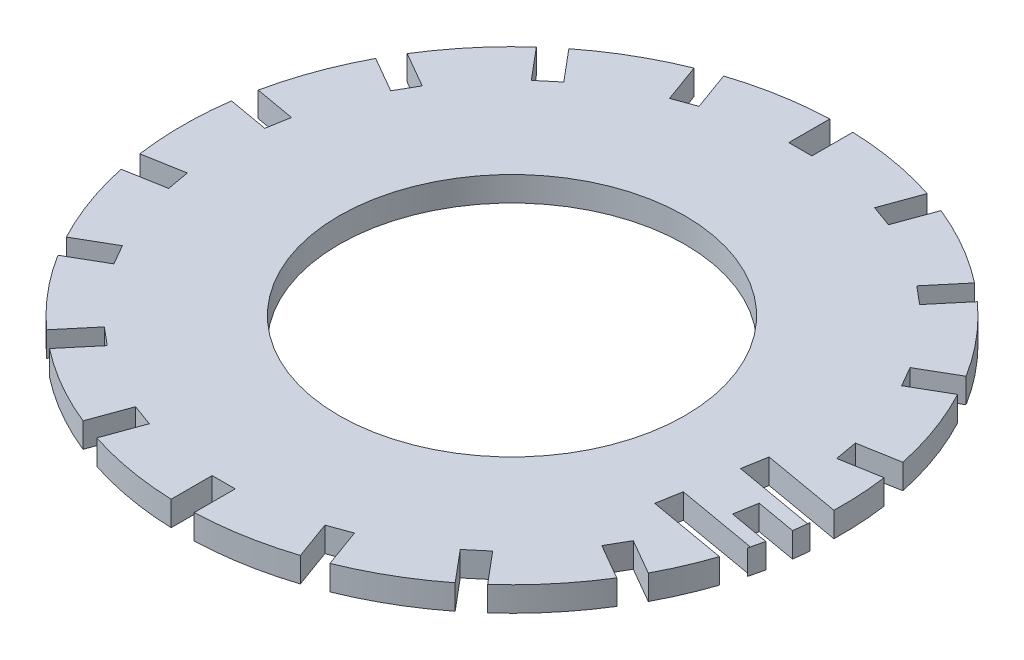
from build123d import *

# Parameters (mm, degrees)
ESQUISSE1_R             = 40
ESQUISSE1_R_2           = 21
BOSS_EXTRU_1_DEPTH      = 3
ENL_V_MAT_EXTRU_1_REACH = 58.648
ESQUISSE2_W             = 2.8
ESQUISSE2_H             = 5
ENL_V_MAT_EXTRU_2_DEPTH = 10


with BuildPart() as part:
    # Esquisse1 → Boss.-Extru.1 (new body)
    with BuildSketch(Plane(origin=(0, 0, 0), x_dir=(1, 0, 0), z_dir=(0, 1, 0))):
        with Locations(Location((0, 0, 0), (0, 0, 270))):
            Circle(ESQUISSE1_R)
        with Locations(Location((0, 0, 0), (0, 0, 270))):
            Circle(ESQUISSE1_R_2, mode=Mode.SUBTRACT)
    extrude(amount=BOSS_EXTRU_1_DEPTH)

    # Esquisse2 → Enlèv. mat.-Extru.1 (cut, up to next)
    with BuildSketch(Plane(origin=(0, 3, 0), x_dir=(1, 0, 0), z_dir=(0, 1, 0)), mode=Mode.PRIVATE) as enl_v_mat_extru_1_sk1:
        Polygon((14.996375402, 37.108876631), (13.286274685, 32.410413527), (10.655135347, 33.368069928), (12.365236064, 38.066533032), align=None)
    enl_v_mat_extru_1_tool1 = extrude(enl_v_mat_extru_1_sk1.sketch, amount=-ENL_V_MAT_EXTRU_1_REACH, mode=Mode.PRIVATE) & part.part
    # Esquisse2 → Enlèv. mat.-Extru.1 (cut, up to next)
    with BuildSketch(Plane(origin=(0, 3, 0), x_dir=(1, 0, 0), z_dir=(0, 1, 0)), mode=Mode.PRIVATE) as enl_v_mat_extru_1_sk2:
        with Locations((0, 37.5)):
            Rectangle(ESQUISSE2_W, ESQUISSE2_H)
    enl_v_mat_extru_1_tool2 = extrude(enl_v_mat_extru_1_sk2.sketch, amount=-ENL_V_MAT_EXTRU_1_REACH, mode=Mode.PRIVATE) & part.part
    # Esquisse2 → Enlèv. mat.-Extru.1 (cut, up to next)
    with BuildSketch(Plane(origin=(0, 3, 0), x_dir=(1, 0, 0), z_dir=(0, 1, 0)), mode=Mode.PRIVATE) as enl_v_mat_extru_1_sk3:
        Polygon((26.783966608, 29.741875071), (23.570028559, 25.911652856), (21.425104119, 27.711458163), (24.639042167, 31.541680378), align=None)
    enl_v_mat_extru_1_tool3 = extrude(enl_v_mat_extru_1_sk3.sketch, amount=-ENL_V_MAT_EXTRU_1_REACH, mode=Mode.PRIVATE) & part.part
    # Esquisse2 → Enlèv. mat.-Extru.1 (cut, up to next)
    with BuildSketch(Plane(origin=(0, 3, 0), x_dir=(1, 0, 0), z_dir=(0, 1, 0)), mode=Mode.PRIVATE) as enl_v_mat_extru_1_sk4:
        Polygon((35.341016151, 18.787564435), (31.010889132, 16.287564435), (29.610889132, 18.712435565), (33.941016151, 21.212435565), align=None)
    enl_v_mat_extru_1_tool4 = extrude(enl_v_mat_extru_1_sk4.sketch, amount=-ENL_V_MAT_EXTRU_1_REACH, mode=Mode.PRIVATE) & part.part
    # Esquisse2 → Enlèv. mat.-Extru.1 (cut, up to next)
    with BuildSketch(Plane(origin=(0, 3, 0), x_dir=(1, 0, 0), z_dir=(0, 1, 0)), mode=Mode.PRIVATE) as enl_v_mat_extru_1_sk5:
        Polygon((39.635417569, 5.567196252), (34.711378804, 4.698955364), (34.225163907, 7.456417073), (39.149202672, 8.324657961), align=None)
    enl_v_mat_extru_1_tool5 = extrude(enl_v_mat_extru_1_sk5.sketch, amount=-ENL_V_MAT_EXTRU_1_REACH, mode=Mode.PRIVATE) & part.part
    # Esquisse2 → Enlèv. mat.-Extru.1 (cut, up to next)
    with BuildSketch(Plane(origin=(0, 3, 0), x_dir=(1, 0, 0), z_dir=(0, 1, 0)), mode=Mode.PRIVATE) as enl_v_mat_extru_1_sk6:
        Polygon((39.149202672, -8.324657961), (34.225163907, -7.456417073), (34.711378804, -4.698955364), (39.635417569, -5.567196252), align=None)
    enl_v_mat_extru_1_tool6 = extrude(enl_v_mat_extru_1_sk6.sketch, amount=-ENL_V_MAT_EXTRU_1_REACH, mode=Mode.PRIVATE) & part.part
    # Esquisse2 → Enlèv. mat.-Extru.1 (cut, up to next)
    with BuildSketch(Plane(origin=(0, 3, 0), x_dir=(1, 0, 0), z_dir=(0, 1, 0)), mode=Mode.PRIVATE) as enl_v_mat_extru_1_sk7:
        Polygon((33.941016151, -21.212435565), (29.610889132, -18.712435565), (31.010889132, -16.287564435), (35.341016151, -18.787564435), align=None)
    enl_v_mat_extru_1_tool7 = extrude(enl_v_mat_extru_1_sk7.sketch, amount=-ENL_V_MAT_EXTRU_1_REACH, mode=Mode.PRIVATE) & part.part
    # Esquisse2 → Enlèv. mat.-Extru.1 (cut, up to next)
    with BuildSketch(Plane(origin=(0, 3, 0), x_dir=(1, 0, 0), z_dir=(0, 1, 0)), mode=Mode.PRIVATE) as enl_v_mat_extru_1_sk8:
        Polygon((24.639042167, -31.541680378), (21.425104119, -27.711458163), (23.570028559, -25.911652856), (26.783966608, -29.741875071), align=None)
    enl_v_mat_extru_1_tool8 = extrude(enl_v_mat_extru_1_sk8.sketch, amount=-ENL_V_MAT_EXTRU_1_REACH, mode=Mode.PRIVATE) & part.part
    # Esquisse2 → Enlèv. mat.-Extru.1 (cut, up to next)
    with BuildSketch(Plane(origin=(0, 3, 0), x_dir=(1, 0, 0), z_dir=(0, 1, 0)), mode=Mode.PRIVATE) as enl_v_mat_extru_1_sk9:
        Polygon((12.365236064, -38.066533032), (10.655135347, -33.368069928), (13.286274686, -32.410413527), (14.996375402, -37.108876631), align=None)
    enl_v_mat_extru_1_tool9 = extrude(enl_v_mat_extru_1_sk9.sketch, amount=-ENL_V_MAT_EXTRU_1_REACH, mode=Mode.PRIVATE) & part.part
    # Esquisse2 → Enlèv. mat.-Extru.1 (cut, up to next)
    with BuildSketch(Plane(origin=(0, 3, 0), x_dir=(1, 0, 0), z_dir=(0, 1, 0)), mode=Mode.PRIVATE) as enl_v_mat_extru_1_sk10:
        with Locations((0, -37.5)):
            Rectangle(ESQUISSE2_W, ESQUISSE2_H)
    enl_v_mat_extru_1_tool10 = extrude(enl_v_mat_extru_1_sk10.sketch, amount=-ENL_V_MAT_EXTRU_1_REACH, mode=Mode.PRIVATE) & part.part
    # Esquisse2 → Enlèv. mat.-Extru.1 (cut, up to next)
    with BuildSketch(Plane(origin=(0, 3, 0), x_dir=(1, 0, 0), z_dir=(0, 1, 0)), mode=Mode.PRIVATE) as enl_v_mat_extru_1_sk11:
        Polygon((-14.996375402, -37.108876631), (-13.286274685, -32.410413527), (-10.655135347, -33.368069928), (-12.365236064, -38.066533032), align=None)
    enl_v_mat_extru_1_tool11 = extrude(enl_v_mat_extru_1_sk11.sketch, amount=-ENL_V_MAT_EXTRU_1_REACH, mode=Mode.PRIVATE) & part.part
    # Esquisse2 → Enlèv. mat.-Extru.1 (cut, up to next)
    with BuildSketch(Plane(origin=(0, 3, 0), x_dir=(1, 0, 0), z_dir=(0, 1, 0)), mode=Mode.PRIVATE) as enl_v_mat_extru_1_sk12:
        Polygon((-26.783966608, -29.741875071), (-23.570028559, -25.911652856), (-21.425104119, -27.711458163), (-24.639042167, -31.541680378), align=None)
    enl_v_mat_extru_1_tool12 = extrude(enl_v_mat_extru_1_sk12.sketch, amount=-ENL_V_MAT_EXTRU_1_REACH, mode=Mode.PRIVATE) & part.part
    # Esquisse2 → Enlèv. mat.-Extru.1 (cut, up to next)
    with BuildSketch(Plane(origin=(0, 3, 0), x_dir=(1, 0, 0), z_dir=(0, 1, 0)), mode=Mode.PRIVATE) as enl_v_mat_extru_1_sk13:
        Polygon((-35.341016151, -18.787564435), (-31.010889132, -16.287564435), (-29.610889132, -18.712435565), (-33.941016151, -21.212435565), align=None)
    enl_v_mat_extru_1_tool13 = extrude(enl_v_mat_extru_1_sk13.sketch, amount=-ENL_V_MAT_EXTRU_1_REACH, mode=Mode.PRIVATE) & part.part
    # Esquisse2 → Enlèv. mat.-Extru.1 (cut, up to next)
    with BuildSketch(Plane(origin=(0, 3, 0), x_dir=(1, 0, 0), z_dir=(0, 1, 0)), mode=Mode.PRIVATE) as enl_v_mat_extru_1_sk14:
        Polygon((-39.635417569, -5.567196252), (-34.711378804, -4.698955364), (-34.225163907, -7.456417073), (-39.149202672, -8.324657961), align=None)
    enl_v_mat_extru_1_tool14 = extrude(enl_v_mat_extru_1_sk14.sketch, amount=-ENL_V_MAT_EXTRU_1_REACH, mode=Mode.PRIVATE) & part.part
    # Esquisse2 → Enlèv. mat.-Extru.1 (cut, up to next)
    with BuildSketch(Plane(origin=(0, 3, 0), x_dir=(1, 0, 0), z_dir=(0, 1, 0)), mode=Mode.PRIVATE) as enl_v_mat_extru_1_sk15:
        Polygon((-39.149202672, 8.324657961), (-34.225163907, 7.456417073), (-34.711378804, 4.698955364), (-39.635417569, 5.567196252), align=None)
    enl_v_mat_extru_1_tool15 = extrude(enl_v_mat_extru_1_sk15.sketch, amount=-ENL_V_MAT_EXTRU_1_REACH, mode=Mode.PRIVATE) & part.part
    # Esquisse2 → Enlèv. mat.-Extru.1 (cut, up to next)
    with BuildSketch(Plane(origin=(0, 3, 0), x_dir=(1, 0, 0), z_dir=(0, 1, 0)), mode=Mode.PRIVATE) as enl_v_mat_extru_1_sk16:
        Polygon((-33.941016151, 21.212435565), (-29.610889132, 18.712435565), (-31.010889132, 16.287564435), (-35.341016151, 18.787564435), align=None)
    enl_v_mat_extru_1_tool16 = extrude(enl_v_mat_extru_1_sk16.sketch, amount=-ENL_V_MAT_EXTRU_1_REACH, mode=Mode.PRIVATE) & part.part
    # Esquisse2 → Enlèv. mat.-Extru.1 (cut, up to next)
    with BuildSketch(Plane(origin=(0, 3, 0), x_dir=(1, 0, 0), z_dir=(0, 1, 0)), mode=Mode.PRIVATE) as enl_v_mat_extru_1_sk17:
        Polygon((-24.639042167, 31.541680378), (-21.425104119, 27.711458163), (-23.570028559, 25.911652856), (-26.783966608, 29.741875071), align=None)
    enl_v_mat_extru_1_tool17 = extrude(enl_v_mat_extru_1_sk17.sketch, amount=-ENL_V_MAT_EXTRU_1_REACH, mode=Mode.PRIVATE) & part.part
    # Esquisse2 → Enlèv. mat.-Extru.1 (cut, up to next)
    with BuildSketch(Plane(origin=(0, 3, 0), x_dir=(1, 0, 0), z_dir=(0, 1, 0)), mode=Mode.PRIVATE) as enl_v_mat_extru_1_sk18:
        Polygon((-12.365236064, 38.066533032), (-10.655135347, 33.368069928), (-13.286274685, 32.410413527), (-14.996375402, 37.108876631), align=None)
    enl_v_mat_extru_1_tool18 = extrude(enl_v_mat_extru_1_sk18.sketch, amount=-ENL_V_MAT_EXTRU_1_REACH, mode=Mode.PRIVATE) & part.part
    add(enl_v_mat_extru_1_tool1.solids().sort_by_distance((12.825755, 3, -35.238473))[0], mode=Mode.SUBTRACT)
    add(enl_v_mat_extru_1_tool2.solids().sort_by_distance((0, 3, -37.5))[0], mode=Mode.SUBTRACT)
    add(enl_v_mat_extru_1_tool3.solids().sort_by_distance((24.104535, 3, -28.726667))[0], mode=Mode.SUBTRACT)
    add(enl_v_mat_extru_1_tool4.solids().sort_by_distance((32.475953, 3, -18.75))[0], mode=Mode.SUBTRACT)
    add(enl_v_mat_extru_1_tool5.solids().sort_by_distance((36.930291, 3, -6.511807))[0], mode=Mode.SUBTRACT)
    add(enl_v_mat_extru_1_tool6.solids().sort_by_distance((36.930291, 3, 6.511807))[0], mode=Mode.SUBTRACT)
    add(enl_v_mat_extru_1_tool7.solids().sort_by_distance((32.475953, 3, 18.75))[0], mode=Mode.SUBTRACT)
    add(enl_v_mat_extru_1_tool8.solids().sort_by_distance((24.104535, 3, 28.726667))[0], mode=Mode.SUBTRACT)
    add(enl_v_mat_extru_1_tool9.solids().sort_by_distance((12.825755, 3, 35.238473))[0], mode=Mode.SUBTRACT)
    add(enl_v_mat_extru_1_tool10.solids().sort_by_distance((0, 3, 37.5))[0], mode=Mode.SUBTRACT)
    add(enl_v_mat_extru_1_tool11.solids().sort_by_distance((-12.825755, 3, 35.238473))[0], mode=Mode.SUBTRACT)
    add(enl_v_mat_extru_1_tool12.solids().sort_by_distance((-24.104535, 3, 28.726667))[0], mode=Mode.SUBTRACT)
    add(enl_v_mat_extru_1_tool13.solids().sort_by_distance((-32.475953, 3, 18.75))[0], mode=Mode.SUBTRACT)
    add(enl_v_mat_extru_1_tool14.solids().sort_by_distance((-36.930291, 3, 6.511807))[0], mode=Mode.SUBTRACT)
    add(enl_v_mat_extru_1_tool15.solids().sort_by_distance((-36.930291, 3, -6.511807))[0], mode=Mode.SUBTRACT)
    add(enl_v_mat_extru_1_tool16.solids().sort_by_distance((-32.475953, 3, -18.75))[0], mode=Mode.SUBTRACT)
    add(enl_v_mat_extru_1_tool17.solids().sort_by_distance((-24.104535, 3, -28.726667))[0], mode=Mode.SUBTRACT)
    add(enl_v_mat_extru_1_tool18.solids().sort_by_distance((-12.825755, 3, -35.238473))[0], mode=Mode.SUBTRACT)

    # Esquisse3 → Enlèv. mat.-Extru.2 (cut)
    with BuildSketch(Plane(origin=(0, 3, 0), x_dir=(1, 0, 0), z_dir=(0, 1, 0))):
        Polygon((30.453131782, 0.758053416), (29.935617441, -2.196972626), (39.785704247, -3.922020428), (40.303218588, -0.966994387), align=None)
        Polygon((28.383074419, -11.062050751), (28.90058876, -8.107024709), (38.750675566, -9.832072512), (38.233161225, -12.787098553), align=None)
    extrude(amount=-ENL_V_MAT_EXTRU_2_DEPTH, mode=Mode.SUBTRACT)


solid = part.part
